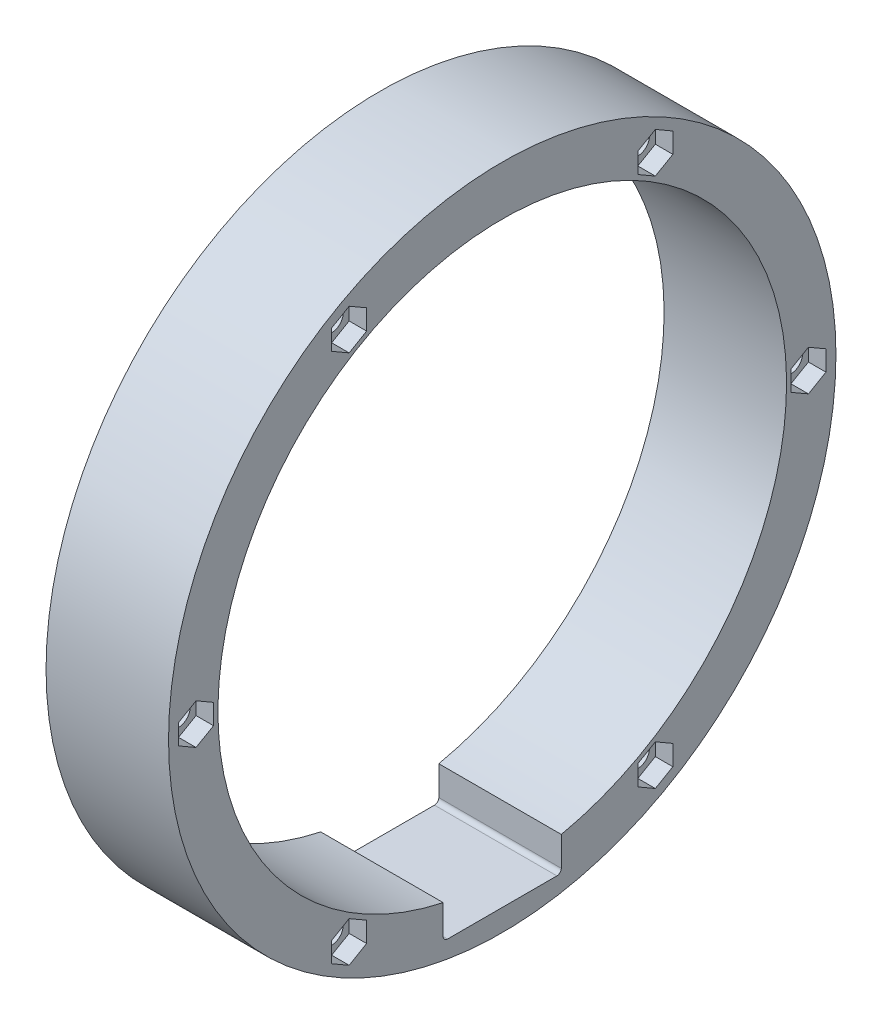
from build123d import *

# Parameters (mm, degrees)
SKETCH1_R           = 76.29
SKETCH1_R_2         = 65
BOSS_EXTRUDE1_DEPTH = 28
CUT_EXTRUDE1_REACH  = 113.464
CUT_EXTRUDE2_REACH  = 113.464
SKETCH3_R           = 2.65
CUT_EXTRUDE3_DEPTH  = 4


with BuildPart() as part:
    # Sketch1 → Boss-Extrude1 (new body)
    with BuildSketch(Plane(origin=(0, 0, 0), x_dir=(0, 0, -1), z_dir=(1, 0, 0))):
        Circle(SKETCH1_R)
        Circle(SKETCH1_R_2, mode=Mode.SUBTRACT)
    extrude(amount=BOSS_EXTRUDE1_DEPTH)

    # Sketch2 → Cut-Extrude1 (cut, up to next)
    with BuildSketch(Plane(origin=(28, 0, 0), x_dir=(0, 0, -1), z_dir=(1, 0, 0)), mode=Mode.PRIVATE) as cut_extrude1_sk1:
        with BuildLine():
            Line((-13.5, -51.893967527), (13.5, -51.893967527))
            Line((13.5, -51.893967527), (13.5, -70.29))
            ThreePointArc((13.5, -70.29), (13.207106781, -70.997106781), (12.5, -71.29))
            Line((12.5, -71.29), (-12.5, -71.29))
            ThreePointArc((-12.5, -71.29), (-13.207106781, -70.997106781), (-13.5, -70.29))
            Line((-13.5, -70.29), (-13.5, -51.893967527))
        make_face()
    cut_extrude1_tool1 = extrude(cut_extrude1_sk1.sketch, amount=-CUT_EXTRUDE1_REACH, mode=Mode.PRIVATE) & part.part
    add(cut_extrude1_tool1.solids().sort_by_distance((28, -61.584212, 0))[0], mode=Mode.SUBTRACT)

    # Sketch3 → Cut-Extrude2 (cut, up to next)
    with BuildSketch(Plane(origin=(28, 0, 0), x_dir=(0, 0, -1), z_dir=(1, 0, 0)), mode=Mode.PRIVATE) as cut_extrude2_sk1:
        with Locations((-70, 0)):
            Circle(SKETCH3_R)
    cut_extrude2_tool1 = extrude(cut_extrude2_sk1.sketch, amount=-CUT_EXTRUDE2_REACH, mode=Mode.PRIVATE) & part.part
    # Sketch3 → Cut-Extrude2 (cut, up to next)
    with BuildSketch(Plane(origin=(28, 0, 0), x_dir=(0, 0, -1), z_dir=(1, 0, 0)), mode=Mode.PRIVATE) as cut_extrude2_sk2:
        with Locations((-35, 60.621778265)):
            Circle(SKETCH3_R)
    cut_extrude2_tool2 = extrude(cut_extrude2_sk2.sketch, amount=-CUT_EXTRUDE2_REACH, mode=Mode.PRIVATE) & part.part
    # Sketch3 → Cut-Extrude2 (cut, up to next)
    with BuildSketch(Plane(origin=(28, 0, 0), x_dir=(0, 0, -1), z_dir=(1, 0, 0)), mode=Mode.PRIVATE) as cut_extrude2_sk3:
        with Locations((35, 60.621778265)):
            Circle(SKETCH3_R)
    cut_extrude2_tool3 = extrude(cut_extrude2_sk3.sketch, amount=-CUT_EXTRUDE2_REACH, mode=Mode.PRIVATE) & part.part
    # Sketch3 → Cut-Extrude2 (cut, up to next)
    with BuildSketch(Plane(origin=(28, 0, 0), x_dir=(0, 0, -1), z_dir=(1, 0, 0)), mode=Mode.PRIVATE) as cut_extrude2_sk4:
        with Locations((70, 0)):
            Circle(SKETCH3_R)
    cut_extrude2_tool4 = extrude(cut_extrude2_sk4.sketch, amount=-CUT_EXTRUDE2_REACH, mode=Mode.PRIVATE) & part.part
    # Sketch3 → Cut-Extrude2 (cut, up to next)
    with BuildSketch(Plane(origin=(28, 0, 0), x_dir=(0, 0, -1), z_dir=(1, 0, 0)), mode=Mode.PRIVATE) as cut_extrude2_sk5:
        with Locations((35, -60.621778265)):
            Circle(SKETCH3_R)
    cut_extrude2_tool5 = extrude(cut_extrude2_sk5.sketch, amount=-CUT_EXTRUDE2_REACH, mode=Mode.PRIVATE) & part.part
    # Sketch3 → Cut-Extrude2 (cut, up to next)
    with BuildSketch(Plane(origin=(28, 0, 0), x_dir=(0, 0, -1), z_dir=(1, 0, 0)), mode=Mode.PRIVATE) as cut_extrude2_sk6:
        with Locations((-35, -60.621778265)):
            Circle(SKETCH3_R)
    cut_extrude2_tool6 = extrude(cut_extrude2_sk6.sketch, amount=-CUT_EXTRUDE2_REACH, mode=Mode.PRIVATE) & part.part
    add(cut_extrude2_tool1.solids().sort_by_distance((28, 0, 70))[0], mode=Mode.SUBTRACT)
    add(cut_extrude2_tool2.solids().sort_by_distance((28, 60.621778, 35))[0], mode=Mode.SUBTRACT)
    add(cut_extrude2_tool3.solids().sort_by_distance((28, 60.621778, -35))[0], mode=Mode.SUBTRACT)
    add(cut_extrude2_tool4.solids().sort_by_distance((28, 0, -70))[0], mode=Mode.SUBTRACT)
    add(cut_extrude2_tool5.solids().sort_by_distance((28, -60.621778, -35))[0], mode=Mode.SUBTRACT)
    add(cut_extrude2_tool6.solids().sort_by_distance((28, -60.621778, 35))[0], mode=Mode.SUBTRACT)

    # Sketch4 → Cut-Extrude3 (cut)
    with BuildSketch(Plane(origin=(28, 0, 0), x_dir=(0, 0, -1), z_dir=(1, 0, 0))):
        Polygon((-39, 58.312377188), (-35, 56.002976111), (-31, 58.312377188), (-31, 62.931179342), (-35, 65.240580418), (-39, 62.931179342), align=None)
        Polygon((-70, -4.618802154), (-66, -2.309401077), (-66, 2.309401077), (-70, 4.618802154), (-74, 2.309401077), (-74, -2.309401077), align=None)
        Polygon((31, 62.931179342), (31, 58.312377188), (35, 56.002976111), (39, 58.312377188), (39, 62.931179342), (35, 65.240580418), align=None)
        Polygon((70, 4.618802154), (66, 2.309401077), (66, -2.309401077), (70, -4.618802154), (74, -2.309401077), (74, 2.309401077), align=None)
        Polygon((39, -58.312377188), (35, -56.002976111), (31, -58.312377188), (31, -62.931179342), (35, -65.240580418), (39, -62.931179342), align=None)
        Polygon((-31, -62.931179342), (-31, -58.312377188), (-35, -56.002976111), (-39, -58.312377188), (-39, -62.931179342), (-35, -65.240580418), align=None)
    extrude(amount=-CUT_EXTRUDE3_DEPTH, mode=Mode.SUBTRACT)


solid = part.part
